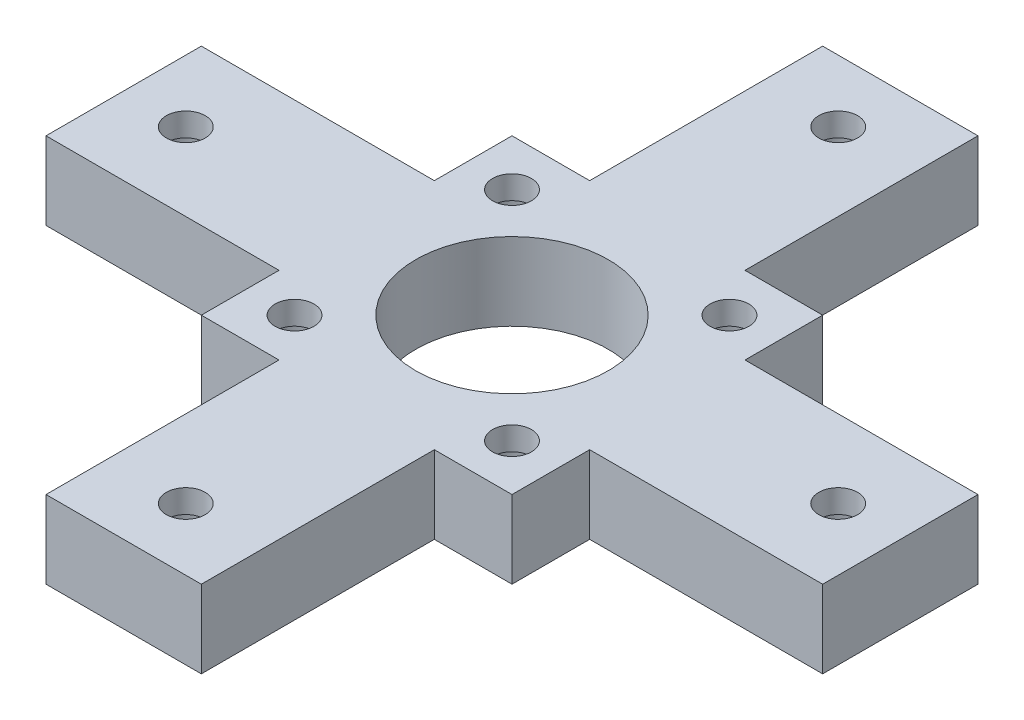
from build123d import *

# Parameters (mm, degrees)
SKETCH_1_W          = 20
SKETCH_1_H          = 20
SKETCH_1_R          = 6.2
SKETCH_1_W_2        = 15
SKETCH_1_H_2        = 10
SKETCH_1_W_3        = 10
SKETCH_1_H_3        = 15
EXTRUDE_1_DEPTH     = 5
SKETCH_2_R          = 1.25
CUT_EXTRUDE_1_DEPTH = 36.707142143
SKETCH_2_3_R        = 2
SKETCH_2_3_R_2      = 1.25
CUT_EXTRUDE_2_DEPTH = 3.5


with BuildPart() as part:
    # 草图1 → 凸台-拉伸1 (new body)
    # profile 1 of 5: a face of its own
    with BuildSketch(Plane(origin=(0, 0, 0), x_dir=(1, 0, 0), z_dir=(0, 1, 0))):
        Rectangle(SKETCH_1_W, SKETCH_1_H)
        with Locations(Location((0, 0, 0), (0, 0, 270))):
            Circle(SKETCH_1_R, mode=Mode.SUBTRACT)
    # profile 2 of 5: a face of its own
    with BuildSketch(Plane(origin=(0, 0, 0), x_dir=(1, 0, 0), z_dir=(0, 1, 0))):
        with Locations((-17.5, 0)):
            Rectangle(SKETCH_1_W_2, SKETCH_1_H_2)
    # profile 3 of 5: a face of its own
    with BuildSketch(Plane(origin=(0, 0, 0), x_dir=(1, 0, 0), z_dir=(0, 1, 0))):
        with Locations((0, -17.5)):
            Rectangle(SKETCH_1_W_3, SKETCH_1_H_3)
    # profile 4 of 5: a face of its own
    with BuildSketch(Plane(origin=(0, 0, 0), x_dir=(1, 0, 0), z_dir=(0, 1, 0))):
        with Locations((0, 17.5)):
            Rectangle(SKETCH_1_W_3, SKETCH_1_H_3)
    # profile 5 of 5: a face of its own
    with BuildSketch(Plane(origin=(0, 0, 0), x_dir=(1, 0, 0), z_dir=(0, 1, 0))):
        with Locations((17.5, 0)):
            Rectangle(SKETCH_1_W_2, SKETCH_1_H_2)
    extrude(amount=EXTRUDE_1_DEPTH)

    # 草图2 → 切除-拉伸1 (cut, through all)
    with BuildSketch(Plane.XZ):
        with Locations(Location((7, 7, 0), (0, 0, 270))):
            Circle(SKETCH_2_R)
        with Locations(Location((7, -7, 0), (0, 0, 270))):
            Circle(SKETCH_2_R)
        with Locations(Location((-7, -7, 0), (0, 0, 270))):
            Circle(SKETCH_2_R)
        with Locations(Location((-7, 7, 0), (0, 0, 270))):
            Circle(SKETCH_2_R)
        with Locations(Location((0, 21, 0), (0, 0, 270))):
            Circle(SKETCH_2_R)
        with Locations(Location((21, 0, 0), (0, 0, 270))):
            Circle(SKETCH_2_R)
        with Locations(Location((0, -21, 0), (0, 0, 270))):
            Circle(SKETCH_2_R)
        with Locations(Location((-21, 0, 0), (0, 0, 270))):
            Circle(SKETCH_2_R)
    extrude(amount=-CUT_EXTRUDE_1_DEPTH, mode=Mode.SUBTRACT)

    # 草图2<3> → 切除-拉伸2 (cut)
    # profile 1 of 8: a face of its own
    with BuildSketch(Plane.XZ):
        with Locations(Location((7, 7, 0), (0, 0, 270))):
            Circle(SKETCH_2_3_R)
        with Locations(Location((7, 7, 0), (0, 0, 270))):
            Circle(SKETCH_2_3_R_2, mode=Mode.SUBTRACT)
    # profile 2 of 8: a face of its own
    with BuildSketch(Plane.XZ):
        with Locations(Location((7, -7, 0), (0, 0, 270))):
            Circle(SKETCH_2_3_R)
        with Locations(Location((7, -7, 0), (0, 0, 270))):
            Circle(SKETCH_2_3_R_2, mode=Mode.SUBTRACT)
    # profile 3 of 8: a face of its own
    with BuildSketch(Plane.XZ):
        with Locations(Location((-7, 7, 0), (0, 0, 270))):
            Circle(SKETCH_2_3_R)
        with Locations(Location((-7, 7, 0), (0, 0, 270))):
            Circle(SKETCH_2_3_R_2, mode=Mode.SUBTRACT)
    # profile 4 of 8: a face of its own
    with BuildSketch(Plane.XZ):
        with Locations(Location((-7, -7, 0), (0, 0, 270))):
            Circle(SKETCH_2_3_R)
        with Locations(Location((-7, -7, 0), (0, 0, 270))):
            Circle(SKETCH_2_3_R_2, mode=Mode.SUBTRACT)
    # profile 5 of 8: a face of its own
    with BuildSketch(Plane.XZ):
        with Locations(Location((0, 21, 0), (0, 0, 270))):
            Circle(SKETCH_2_3_R)
        with Locations(Location((0, 21, 0), (0, 0, 270))):
            Circle(SKETCH_2_3_R_2, mode=Mode.SUBTRACT)
    # profile 6 of 8: a face of its own
    with BuildSketch(Plane.XZ):
        with Locations(Location((21, 0, 0), (0, 0, 270))):
            Circle(SKETCH_2_3_R)
        with Locations(Location((21, 0, 0), (0, 0, 270))):
            Circle(SKETCH_2_3_R_2, mode=Mode.SUBTRACT)
    # profile 7 of 8: a face of its own
    with BuildSketch(Plane.XZ):
        with Locations(Location((0, -21, 0), (0, 0, 270))):
            Circle(SKETCH_2_3_R)
        with Locations(Location((0, -21, 0), (0, 0, 270))):
            Circle(SKETCH_2_3_R_2, mode=Mode.SUBTRACT)
    # profile 8 of 8: a face of its own
    with BuildSketch(Plane.XZ):
        with Locations(Location((-21, 0, 0), (0, 0, 270))):
            Circle(SKETCH_2_3_R)
        with Locations(Location((-21, 0, 0), (0, 0, 270))):
            Circle(SKETCH_2_3_R_2, mode=Mode.SUBTRACT)
    extrude(amount=-CUT_EXTRUDE_2_DEPTH, mode=Mode.SUBTRACT)


solid = part.part
